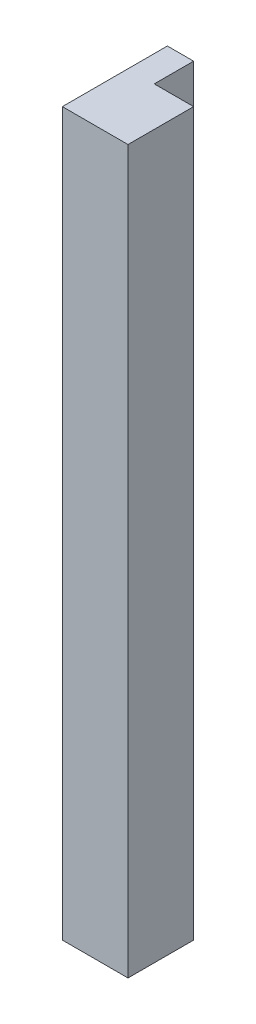
from build123d import *

# Parameters (mm, degrees)
SKETCH1_W           = 5
SKETCH1_H           = 8
BOSS_EXTRUDE1_DEPTH = 55
SKETCH2_W           = 3
SKETCH2_H           = 3
CUT_EXTRUDE1_DEPTH  = 55


with BuildPart() as part:
    # Sketch1 → Boss-Extrude1 (new body)
    with BuildSketch(Plane(origin=(0, 0, 0), x_dir=(1, 0, 0), z_dir=(0, 1, 0))):
        Rectangle(SKETCH1_W, SKETCH1_H)
    extrude(amount=BOSS_EXTRUDE1_DEPTH)

    # Sketch2 → Cut-Extrude1 (cut)
    with BuildSketch(Plane(origin=(0, 0, 0), x_dir=(-1, 0, 0), z_dir=(0, -1, 0))):
        with Locations((-1, 2.5)):
            Rectangle(SKETCH2_W, SKETCH2_H)
    extrude(amount=-CUT_EXTRUDE1_DEPTH, mode=Mode.SUBTRACT)


solid = part.part
